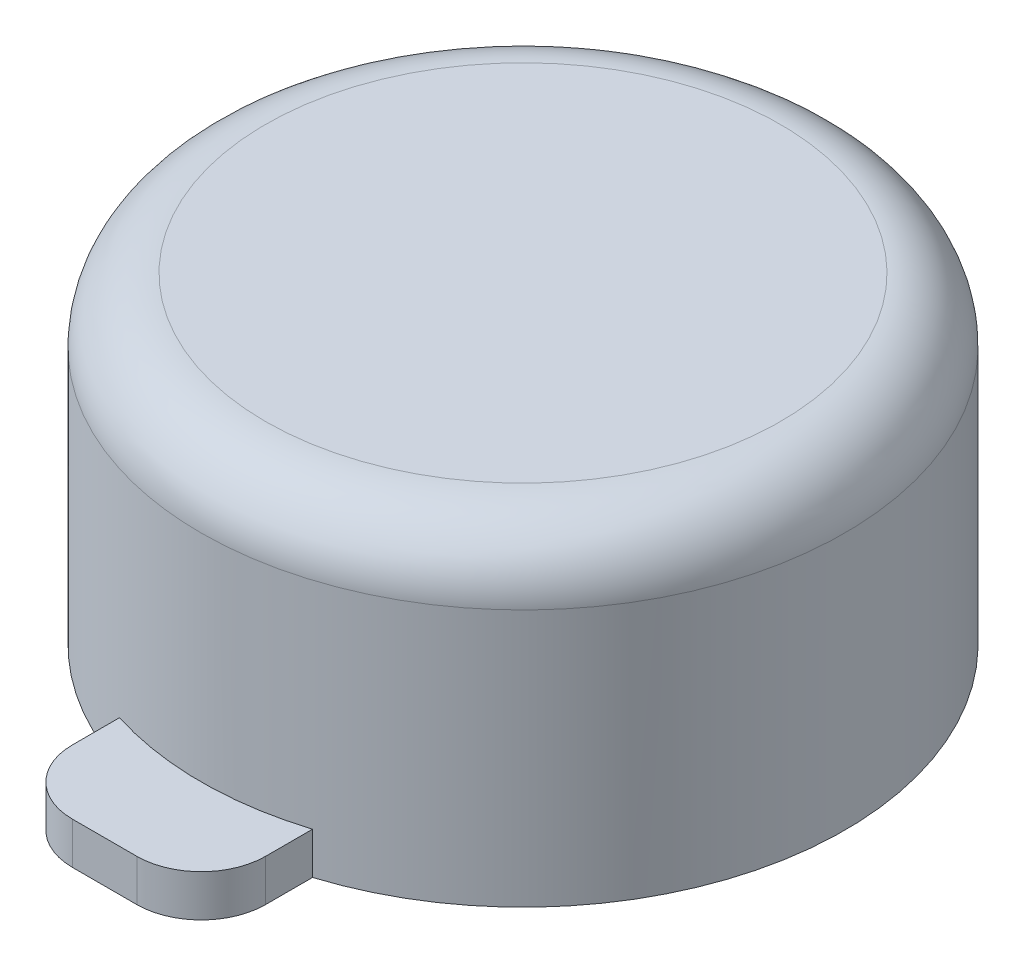
from build123d import *

# Parameters (mm, degrees)
SKETCH1_R                = 12.7
BOSS_EXTRUDE1_DEPTH      = 12.7
FILLET1_R                = 2.54
SHELL1_T                 = -1.27
BOSS_EXTRUDE2_REACH      = 36.29
BOSS_EXTRUDE2_END_RADIUS = 12.7
SKETCH4_W                = 7.62
SKETCH4_H                = 1.651
FILLET2_R                = 2.54


with BuildPart() as part:
    # Sketch1 → Boss-Extrude1 (new body)
    with BuildSketch(Plane(origin=(0, 0, 0), x_dir=(1, 0, 0), z_dir=(0, 1, 0))):
        with Locations(Location((0, 0, 0), (0, 0, 90))):
            Circle(SKETCH1_R)
    extrude(amount=BOSS_EXTRUDE1_DEPTH)

    # Fillet1
    fillet1_edges = [part.edges().sort_by_distance(p)[0] for p in [
        (0, 12.7, 12.7),
    ]]
    fillet(fillet1_edges, radius=FILLET1_R)

    # Shell1
    shell1_openings = [part.faces().sort_by_distance(p)[0] for p in [
        (0, 0, 0),
    ]]
    offset(amount=SHELL1_T, openings=shell1_openings, kind=Kind.INTERSECTION)

    # Boss-Extrude2: up to this cylinder (the profile starts outside it)
    boss_extrude2_end = Plane(origin=(0, 0.8255, 0), z_dir=(0, -1, 0)) * Cylinder(BOSS_EXTRUDE2_END_RADIUS, 98.98, mode=Mode.PRIVATE)
    # Sketch4 → Boss-Extrude2 (add, up to the surface)
    with BuildSketch(Plane.XY.offset(16.51), mode=Mode.PRIVATE) as boss_extrude2_sk1:
        with Locations((0, 0.8255)):
            Rectangle(SKETCH4_W, SKETCH4_H)
    boss_extrude2_tool1 = extrude(boss_extrude2_sk1.sketch, amount=-BOSS_EXTRUDE2_REACH, mode=Mode.PRIVATE) - boss_extrude2_end
    add(boss_extrude2_tool1.solids().sort_by_distance((0, 0.8255, 16.51))[0])

    # Fillet2
    fillet2_edges = [part.edges().sort_by_distance(p)[0] for p in [
        (-3.81, 0.8255, 16.51),
        (3.81, 0.8255, 16.51),
    ]]
    fillet(fillet2_edges, radius=FILLET2_R)


solid = part.part
